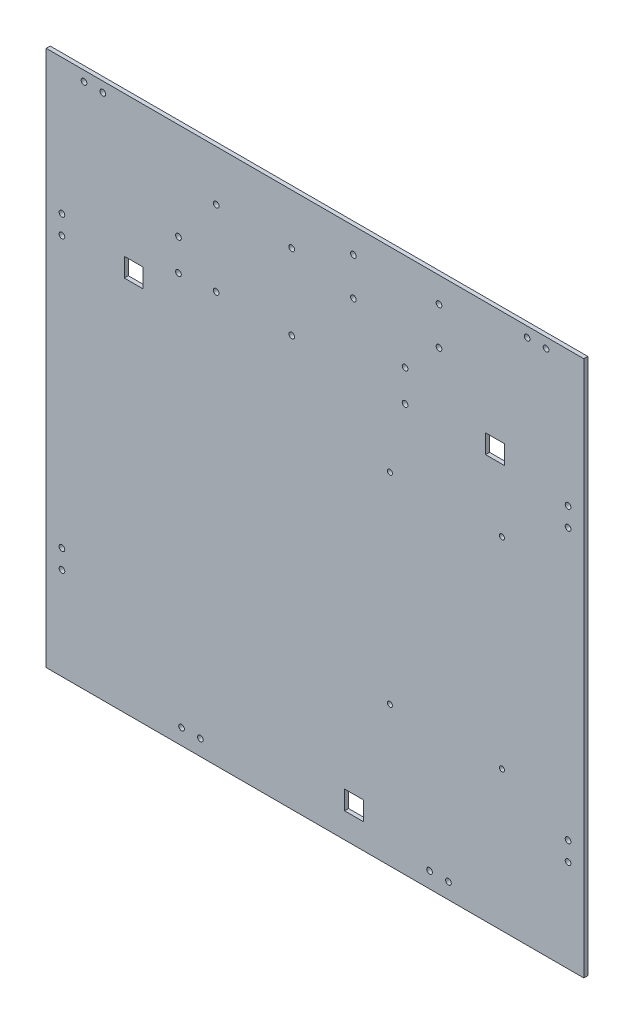
from build123d import *

# Parameters (mm, degrees)
SKETCH1_W           = 427
SKETCH1_H           = 426
BOSS_EXTRUDE1_DEPTH = 3.175
SKETCH2_R           = 2.25
CUT_EXTRUDE1_DEPTH  = 604.170855252
SKETCH3_R           = 2.25
CUT_EXTRUDE2_DEPTH  = 604.170855252
SKETCH4_W           = 15
SKETCH4_H           = 15
CUT_EXTRUDE3_DEPTH  = 604.170855252
SKETCH5_R           = 2
CUT_EXTRUDE4_DEPTH  = 604.170855252
SKETCH6_R           = 2.25
CUT_EXTRUDE5_DEPTH  = 604.170855252
SKETCH7_R           = 2.25
CUT_EXTRUDE6_DEPTH  = 604.170855252
SKETCH8_R           = 2.25
CUT_EXTRUDE7_DEPTH  = 10
SKETCH9_R           = 2.25
CUT_EXTRUDE8_DEPTH  = 10


with BuildPart() as part:
    # Sketch1 → Boss-Extrude1 (new body)
    with BuildSketch(Plane.XY):
        with Locations((213.5, 213)):
            Rectangle(SKETCH1_W, SKETCH1_H)
    extrude(amount=BOSS_EXTRUDE1_DEPTH)

    # Sketch2 → Cut-Extrude1 (cut, through all)
    with BuildSketch(Plane.XY.offset(3.175)):
        with Locations((12.500000062, 318.5)):
            Circle(SKETCH2_R)
        with Locations((12.500000062, 303.5)):
            Circle(SKETCH2_R)
        with Locations((12.500000062, 88.5)):
            Circle(SKETCH2_R)
        with Locations((12.500000062, 73.5)):
            Circle(SKETCH2_R)
        with Locations(Location((414.499999938, 88.5, 0), (0, 0, 180))):
            Circle(SKETCH2_R)
        with Locations(Location((414.499999938, 73.5, 0), (0, 0, 180))):
            Circle(SKETCH2_R)
        with Locations(Location((414.499999938, 318.5, 0), (0, 0, 180))):
            Circle(SKETCH2_R)
        with Locations(Location((414.499999938, 303.5, 0), (0, 0, 180))):
            Circle(SKETCH2_R)
    extrude(amount=-CUT_EXTRUDE1_DEPTH, mode=Mode.SUBTRACT)

    # Sketch3 → Cut-Extrude2 (cut, through all)
    with BuildSketch(Plane.XY.offset(3.175)):
        with Locations((304.5, 12.5)):
            Circle(SKETCH3_R)
        with Locations((319.5, 12.5)):
            Circle(SKETCH3_R)
        with Locations((122.5, 12.5)):
            Circle(SKETCH3_R)
        with Locations((107.5, 12.5)):
            Circle(SKETCH3_R)
    extrude(amount=-CUT_EXTRUDE2_DEPTH, mode=Mode.SUBTRACT)

    # Sketch4 → Cut-Extrude3 (cut, through all)
    with BuildSketch(Plane.XY.offset(3.175)):
        with Locations((244.5, 27.5)):
            Rectangle(SKETCH4_W, SKETCH4_H)
        with Locations((356.5, 328.5)):
            Rectangle(SKETCH4_W, SKETCH4_H)
        with Locations((69.5, 306.5)):
            Rectangle(SKETCH4_W, SKETCH4_H)
    extrude(amount=-CUT_EXTRUDE3_DEPTH, mode=Mode.SUBTRACT)

    # Sketch5 → Cut-Extrude4 (cut, through all)
    with BuildSketch(Plane(origin=(0, 0, 0), x_dir=(-1, 0, 0), z_dir=(0, 0, -1))):
        with Locations((-362, 271)):
            Circle(SKETCH5_R)
        with Locations((-273, 271)):
            Circle(SKETCH5_R)
        with Locations((-362, 111.3)):
            Circle(SKETCH5_R)
        with Locations((-273, 111.3)):
            Circle(SKETCH5_R)
    extrude(amount=-CUT_EXTRUDE4_DEPTH, mode=Mode.SUBTRACT)

    # Sketch6 → Cut-Extrude5 (cut, through all)
    with BuildSketch(Plane(origin=(0, 0, 0), x_dir=(-1, 0, 0), z_dir=(0, 0, -1))):
        with Locations((-195, 386)):
            Circle(SKETCH6_R)
        with Locations((-135, 386)):
            Circle(SKETCH6_R)
        with Locations((-195, 326)):
            Circle(SKETCH6_R)
        with Locations((-135, 326)):
            Circle(SKETCH6_R)
    extrude(amount=-CUT_EXTRUDE5_DEPTH, mode=Mode.SUBTRACT)

    # Sketch7 → Cut-Extrude6 (cut, through all)
    with BuildSketch(Plane(origin=(0, 0, 0), x_dir=(-1, 0, 0), z_dir=(0, 0, -1))):
        with Locations((-312, 406)):
            Circle(SKETCH7_R)
        with Locations((-244, 406)):
            Circle(SKETCH7_R)
        with Locations(Location((-244, 376, 0), (0, 0, 180))):
            Circle(SKETCH7_R)
        with Locations(Location((-312, 376, 0), (0, 0, 180))):
            Circle(SKETCH7_R)
    extrude(amount=-CUT_EXTRUDE6_DEPTH, mode=Mode.SUBTRACT)

    # Sketch8 → Cut-Extrude7 (cut)
    with BuildSketch(Plane.XY.offset(3.175)):
        with Locations((285.04, 348.92)):
            Circle(SKETCH8_R)
        with Locations((105.04, 348.92)):
            Circle(SKETCH8_R)
        with Locations((105.04, 323.92)):
            Circle(SKETCH8_R)
        with Locations((285.04, 323.92)):
            Circle(SKETCH8_R)
    extrude(amount=-CUT_EXTRUDE7_DEPTH, mode=Mode.SUBTRACT)

    # Sketch9 → Cut-Extrude8 (cut)
    with BuildSketch(Plane(origin=(0, 0, 0), x_dir=(-1, 0, 0), z_dir=(0, 0, -1))):
        with Locations((-30, 418)):
            Circle(SKETCH9_R)
        with Locations((-397, 418)):
            Circle(SKETCH9_R)
        with Locations((-382, 418)):
            Circle(SKETCH9_R)
        with Locations((-45, 418)):
            Circle(SKETCH9_R)
    extrude(amount=-CUT_EXTRUDE8_DEPTH, mode=Mode.SUBTRACT)


solid = part.part
